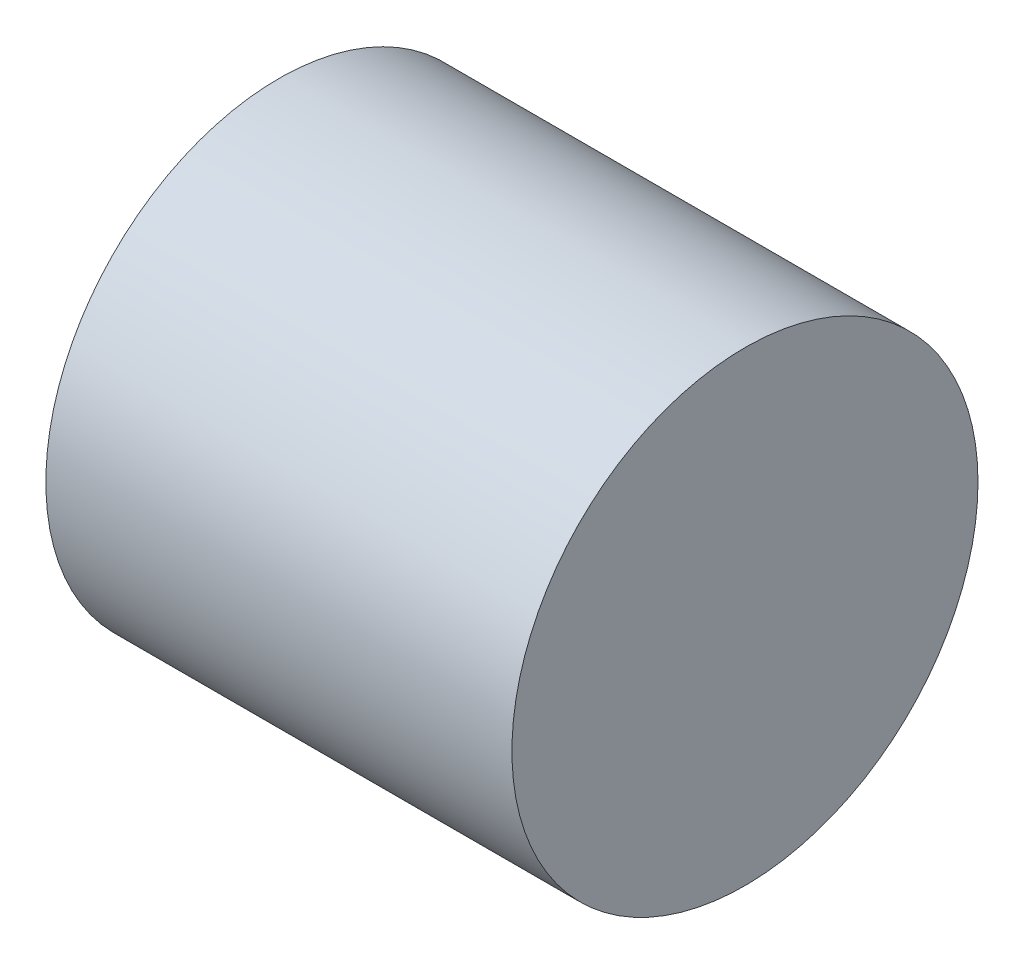
from build123d import *

# Parameters (mm, degrees)
ESQUISSE1_R        = 75
BOSS_EXTRU_1_DEPTH = 150


with BuildPart() as part:
    # Esquisse1 → Boss.-Extru.1 (new body)
    with BuildSketch(Plane(origin=(0, 0, 0), x_dir=(0, 0, -1), z_dir=(1, 0, 0))):
        Circle(ESQUISSE1_R)
    extrude(amount=BOSS_EXTRU_1_DEPTH)


solid = part.part
